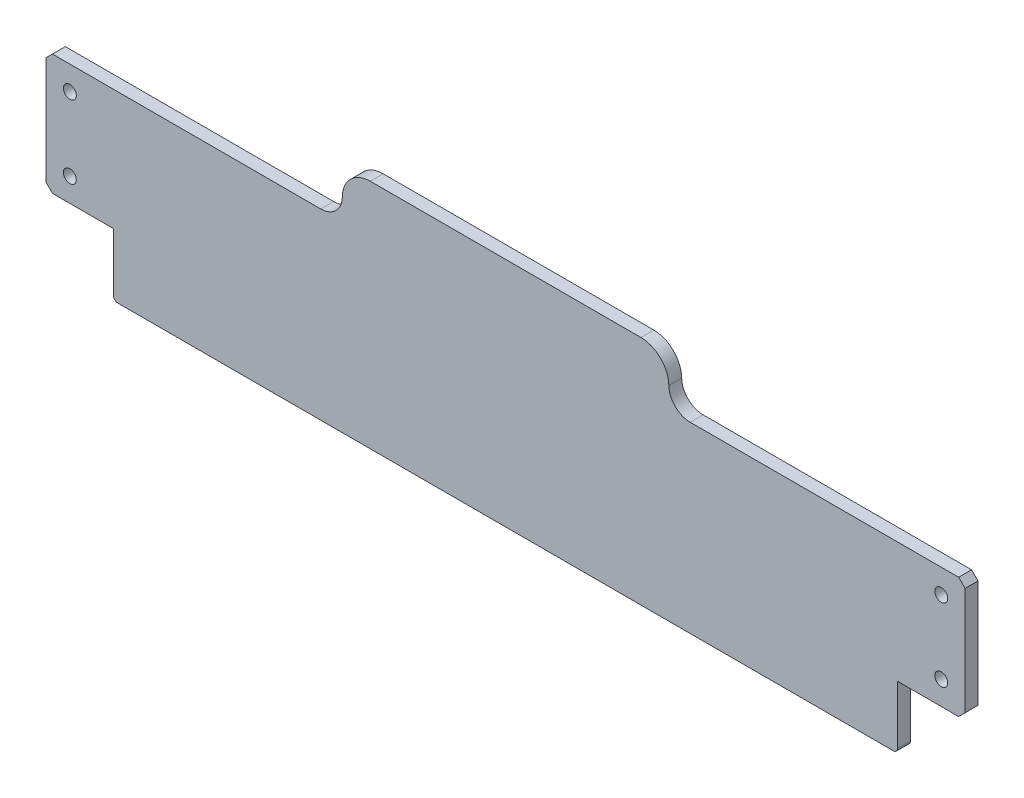
from build123d import *

# Parameters (mm, degrees)
RESSALTO_EXTRUS_O1_DEPTH = 6
ESBO_O2_W                = 87.948383594
ESBO_O2_H                = 90.794457537
CORTE_EXTRUS_O1_DEPTH    = 10
FILETE1_R                = 10
FILETE2_R                = 1
ESBO_O3_W                = 6
ESBO_O3_H                = 20
RESSALTO_EXTRUS_O2_DEPTH = 6
FILETE3_R                = 1
ESBO_O4_W                = 6
ESBO_O4_H                = 9.607959318
CORTE_EXTRUS_O2_DEPTH    = 6
CORTE_EXTRUS_O4_DEPTH    = 413.403928206
ESBO_O7_R                = 2.75
RESSALTO_EXTRUS_O3_DEPTH = 6
FILETE5_R                = 1
FILETE6_R                = 10
ESBO_O9_W                = 65.01383902
ESBO_O9_H                = 118.32551617
ESBO_O9_W_2              = 62.115199348
ESBO_O9_H_2              = 131.353950202
CORTE_EXTRUS_O5_DEPTH    = 417.006009572
ESBO_O10_W               = 6
ESBO_O10_H               = 17
CORTE_EXTRUS_O6_DEPTH    = 390.532068305
ESBO_O11_W               = 365
ESBO_O11_H               = 12
RESSALTO_EXTRUS_O4_DEPTH = 6
ESBO_O12_W               = 25.4
ESBO_O12_H               = 56.170187659
RESSALTO_EXTRUS_O5_DEPTH = 6
CHANFRO1_SIZE            = 3
FILETE7_R                = 2
ESBO_O13_R               = 3
CORTE_EXTRUS_O7_DEPTH    = 414.796075668
ESBO_O14_W               = 154.34893278
ESBO_O14_H               = 36.016450872
CORTE_EXTRUS_O8_DEPTH    = 414.796075668
FILETE8_R                = 13


with BuildPart() as part:
    # Esboço1 → Ressalto-extrusão1 (new body)
    with BuildSketch(Plane.XY):
        Polygon((0, 103.5), (0, 180), (365, 180), (365, 103.5), (371, 103.5), (371, 4.5), (365, 4.5), (365, 0), (0, 0), (0, 4.5), (-6, 4.5), (-6, 103.5), align=None)
    extrude(amount=RESSALTO_EXTRUS_O1_DEPTH)

    # Esboço2 → Corte-extrusão1 (cut)
    with BuildSketch(Plane.XY.offset(6)):
        with Locations((62.547917061, 118.567416428)):
            Rectangle(ESBO_O2_W, ESBO_O2_H)
        with Locations((302.452082939, 118.567416428)):
            Rectangle(ESBO_O2_W, ESBO_O2_H)
    extrude(amount=-CORTE_EXTRUS_O1_DEPTH, mode=Mode.SUBTRACT)

    # Filete1
    filete1_edges = [part.edges().sort_by_distance(p)[0] for p in [
        (18.573725264, 73.170187659, 3),
        (18.573725264, 163.964645196, 3),
        (106.522108858, 163.964645196, 3),
        (106.522108858, 73.170187659, 3),
        (346.426274736, 163.964645196, 3),
        (346.426274736, 73.170187659, 3),
        (258.477891142, 73.170187659, 3),
        (258.477891142, 163.964645196, 3),
    ]]
    fillet(filete1_edges, radius=FILETE1_R)

    # Filete2
    filete2_edges = [part.edges().sort_by_distance(p)[0] for p in [
        (-6, 103.5, 3),
        (-6, 4.5, 3),
        (371, 4.5, 3),
        (371, 103.5, 3),
    ]]
    fillet(filete2_edges, radius=FILETE2_R)

    # Esboço3 → Ressalto-extrusão2 (add)
    with BuildSketch(Plane.XY.offset(6)):
        with Locations((-3, 153.964645196)):
            Rectangle(ESBO_O3_W, ESBO_O3_H)
        with Locations((368, 153.964645196)):
            Rectangle(ESBO_O3_W, ESBO_O3_H)
    extrude(amount=-RESSALTO_EXTRUS_O2_DEPTH)

    # Filete3
    filete3_edges = [part.edges().sort_by_distance(p)[0] for p in [
        (-6, 143.964645196, 3),
        (-6, 163.964645196, 3),
        (371, 163.964645196, 3),
        (371, 143.964645196, 3),
    ]]
    fillet(filete3_edges, radius=FILETE3_R)

    # Esboço4 → Corte-extrusão2 (cut)
    with BuildSketch(Plane(origin=(371, 0, 0), x_dir=(0, 0, -1), z_dir=(1, 0, 0))):
        with Locations((-3, 98.696020341)):
            Rectangle(ESBO_O4_W, ESBO_O4_H)
    extrude(amount=-CORTE_EXTRUS_O2_DEPTH, mode=Mode.SUBTRACT)

    # Esboço6 → Corte-extrusão4 (cut, through all)
    with BuildSketch(Plane.XY.offset(6)):
        Polygon((106.522108858, 118.567416428), (258.477891142, 118.567416428), (346.426274736, 153.964645196), (346.426274736, 180), (18.573725264, 180), (18.573725264, 153.964645196), align=None)
    extrude(amount=-CORTE_EXTRUS_O4_DEPTH, mode=Mode.SUBTRACT)

    # Esboço7 → Ressalto-extrusão3 (add, through all)
    # profile 1 of 2: a face of its own
    with BuildSketch(Plane.XY.offset(6)):
        with BuildLine():
            ThreePointArc((-5, 163.964645196), (-15, 153.964645196), (-5, 143.964645196))
            ThreePointArc((-5, 143.964645196), (-3.426448861, 153.964645196), (-5, 163.964645196))
        make_face()
        with Locations((-9, 153.964645196)):
            Circle(ESBO_O7_R, mode=Mode.SUBTRACT)
    # profile 2 of 2: a face of its own
    with BuildSketch(Plane.XY.offset(6)):
        with BuildLine():
            ThreePointArc((365, 163.964645196), (363.426448861, 153.964645196), (365, 143.964645196))
            ThreePointArc((365, 143.964645196), (375, 153.964645196), (365, 163.964645196))
        make_face()
        with Locations((369, 153.964645196)):
            Circle(ESBO_O7_R, mode=Mode.SUBTRACT)
    extrude(amount=-RESSALTO_EXTRUS_O3_DEPTH)

    # Filete5
    filete5_edges = [part.edges().sort_by_distance(p)[0] for p in [
        (365, 180, 3),
        (0, 180, 3),
    ]]
    fillet(filete5_edges, radius=FILETE5_R)

    # Filete6
    filete6_edges = [part.edges().sort_by_distance(p)[0] for p in [
        (106.522108858, 118.567416428, 3),
        (258.477891142, 118.567416428, 3),
    ]]
    fillet(filete6_edges, radius=FILETE6_R)

    # Esboço9 → Corte-extrusão5 (cut, through all)
    with BuildSketch(Plane.XY.offset(6)):
        with Locations((-3.933194246, 132.332945744)):
            Rectangle(ESBO_O9_W, ESBO_O9_H)
        with Locations((367.48387441, 138.84716276)):
            Rectangle(ESBO_O9_W_2, ESBO_O9_H_2)
    extrude(amount=-CORTE_EXTRUS_O5_DEPTH, mode=Mode.SUBTRACT)

    # Esboço10 → Corte-extrusão6 (cut, through all)
    with BuildSketch(Plane.XY.offset(6)):
        with Locations((-3, 8.5)):
            Rectangle(ESBO_O10_W, ESBO_O10_H)
        with Locations((368, 8.5)):
            Rectangle(ESBO_O10_W, ESBO_O10_H)
    extrude(amount=-CORTE_EXTRUS_O6_DEPTH, mode=Mode.SUBTRACT)

    # Esboço11 → Ressalto-extrusão4 (add, through all)
    with BuildSketch(Plane.XY.offset(6)):
        with Locations((182.5, -6)):
            Rectangle(ESBO_O11_W, ESBO_O11_H)
    extrude(amount=-RESSALTO_EXTRUS_O4_DEPTH)

    # Esboço12 → Ressalto-extrusão5 (add, through all)
    with BuildSketch(Plane.XY.offset(6)):
        with Locations((383.7, 45.08509383)):
            Rectangle(ESBO_O12_W, ESBO_O12_H)
        with Locations((-18.7, 45.08509383)):
            Rectangle(ESBO_O12_W, ESBO_O12_H)
    extrude(amount=-RESSALTO_EXTRUS_O5_DEPTH)

    # Chanfro1
    chanfro1_edges = [part.edges().sort_by_distance(p)[0] for p in [
        (396.4, 73.170187659, 3),
        (396.4, 17, 3),
        (-31.4, 17, 3),
        (-31.4, 73.170187659, 3),
    ]]
    chamfer(chanfro1_edges, length=CHANFRO1_SIZE)

    # Filete7
    filete7_edges = [part.edges().sort_by_distance(p)[0] for p in [
        (0, -12, 3),
        (365, -12, 3),
    ]]
    fillet(filete7_edges, radius=FILETE7_R)

    # Esboço13 → Corte-extrusão7 (cut, through all)
    with BuildSketch(Plane.XY.offset(6)):
        with Locations((-20.3, 62)):
            Circle(ESBO_O13_R)
        with Locations((-20.3, 28)):
            Circle(ESBO_O13_R)
        with Locations(Location((385.3, 28, 0), (0, 0, 180))):
            Circle(ESBO_O13_R)
        with Locations(Location((385.3, 62, 0), (0, 0, 180))):
            Circle(ESBO_O13_R)
    extrude(amount=-CORTE_EXTRUS_O7_DEPTH, mode=Mode.SUBTRACT)

    # Esboço14 → Corte-extrusão8 (cut, through all)
    with BuildSketch(Plane.XY.offset(6)):
        with Locations((183.696575248, 113.87702748)):
            Rectangle(ESBO_O14_W, ESBO_O14_H)
    extrude(amount=-CORTE_EXTRUS_O8_DEPTH, mode=Mode.SUBTRACT)

    # Filete8
    filete8_edges = [part.edges().sort_by_distance(p)[0] for p in [
        (106.522108858, 95.868802044, 3),
        (258.477891142, 95.868802044, 3),
    ]]
    fillet(filete8_edges, radius=FILETE8_R)


solid = part.part
